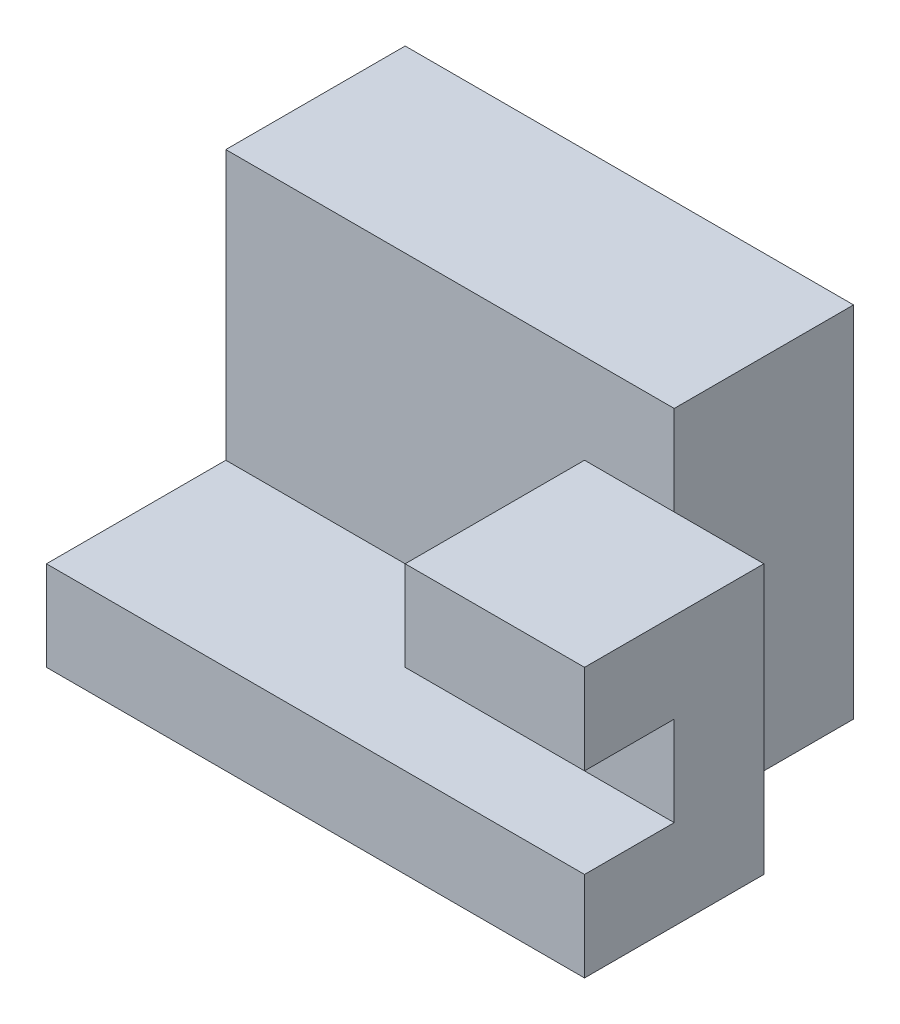
from build123d import *

# Parameters (mm, degrees)
SKETCH_1_W           = 10
SKETCH_1_H           = 5
SKETCH_1_H_2         = 20
EXTRUDE_1_DEPTH      = 25
EXTRUDE_2_DEPTH      = 5
EXTRUDE_2_DEPTH_BACK = 5


with BuildPart() as part:
    # 草圖1 → 填料-伸長1 (new body)
    with BuildSketch(Plane(origin=(0, 0, 0), x_dir=(0, 0, -1), z_dir=(1, 0, 0))):
        with Locations((-5, 2.5)):
            Rectangle(SKETCH_1_W, SKETCH_1_H)
        with Locations((5, 10)):
            Rectangle(SKETCH_1_W, SKETCH_1_H_2)
    extrude(amount=-EXTRUDE_1_DEPTH)

    # 草圖2 → 填料-伸長2 (add, two sides: drawn at the far end of the back side and taken through both)
    with BuildSketch(Plane(origin=(0, 0, 0), x_dir=(0, 0, -1), z_dir=(1, 0, 0)).offset(-EXTRUDE_2_DEPTH_BACK)):
        Polygon((-10, 15), (0, 15), (0, 0), (-10, 0), (-10, 5), (-5, 5), (-5, 10), (-10, 10), align=None)
    extrude(amount=EXTRUDE_2_DEPTH + EXTRUDE_2_DEPTH_BACK)


solid = part.part
